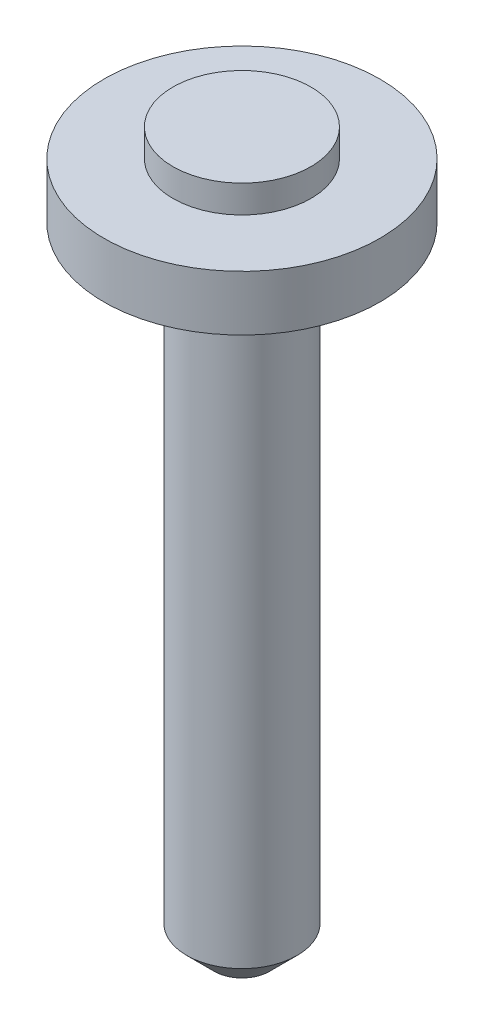
from build123d import *

# Parameters (mm, degrees)
CHAMFER1_SIZE       = 1
SKETCH2_R           = 2.5
BOSS_EXTRUDE1_DEPTH = 1


with BuildPart() as part:
    # Sketch1 → Revolve1 (revolve)
    with BuildSketch(Plane.XY, mode=Mode.PRIVATE) as revolve1_sk:
        Polygon((0, 25), (-5, 25), (-5, 23), (-2.5, 23), (-2.5, 22), (-2, 22), (-2, 0), (-0.45, 0), (-0.45, 19), (0, 19), align=None)
    revolve(revolve1_sk.sketch.rotate(Axis((0, 0, 0), (0, 1, 0)), 270), axis=Axis((0, 0, 0), (0, 1, 0)))

    # Chamfer1
    chamfer1_edges = [part.edges().sort_by_distance(p)[0] for p in [
        (0, 0, 2),
    ]]
    chamfer(chamfer1_edges, length=CHAMFER1_SIZE)

    # Sketch2 → Boss-Extrude1 (add)
    with BuildSketch(Plane(origin=(0, 25, 0), x_dir=(1, 0, 0), z_dir=(0, 1, 0))):
        with Locations(Location((0, 0, 0), (0, 0, 90))):
            Circle(SKETCH2_R)
    extrude(amount=BOSS_EXTRUDE1_DEPTH)


solid = part.part
